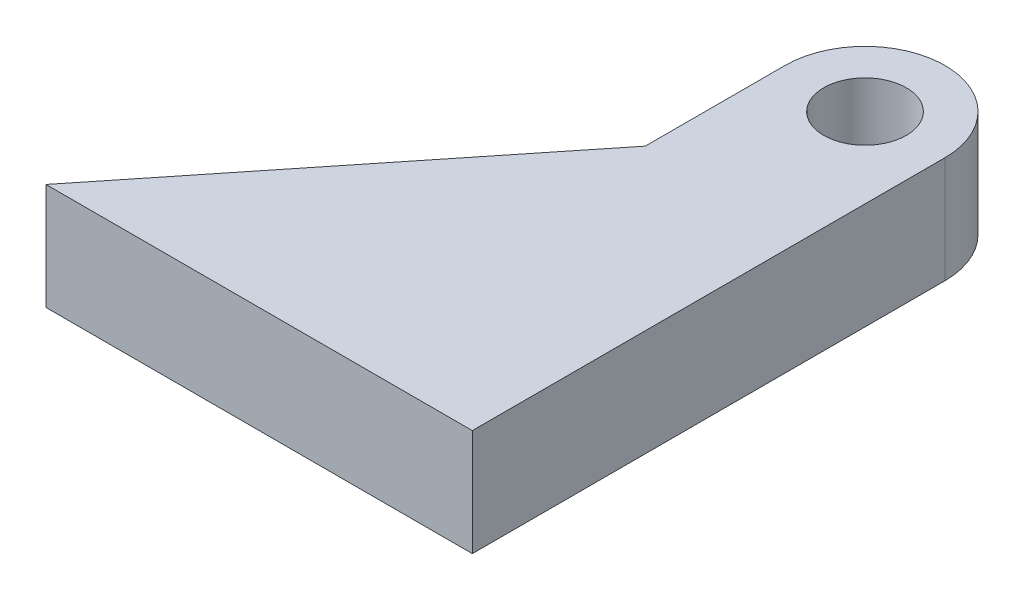
from build123d import *

# Parameters (mm, degrees)
SKETCH1_R           = 7.75
BOSS_EXTRUDE1_DEPTH = 20


with BuildPart() as part:
    # Sketch1 → Boss-Extrude1 (new body)
    with BuildSketch(Plane(origin=(0, 0, 0), x_dir=(1, 0, 0), z_dir=(0, 1, 0))):
        with BuildLine():
            Line((-15, 0), (-15.006952556, -26.238275495))
            Line((-15.006952556, -26.238275495), (-65.001652527, -88.69249853))
            Line((-65.001652527, -88.69249853), (15, -88.69249853))
            Line((15, -88.69249853), (15, 0))
            ThreePointArc((15, 0), (0, 14.996025862), (-15, 0))
        make_face()
        with Locations(Location((0, 0, 0), (0, 0, 270))):
            Circle(SKETCH1_R, mode=Mode.SUBTRACT)
    extrude(amount=BOSS_EXTRUDE1_DEPTH)


solid = part.part
